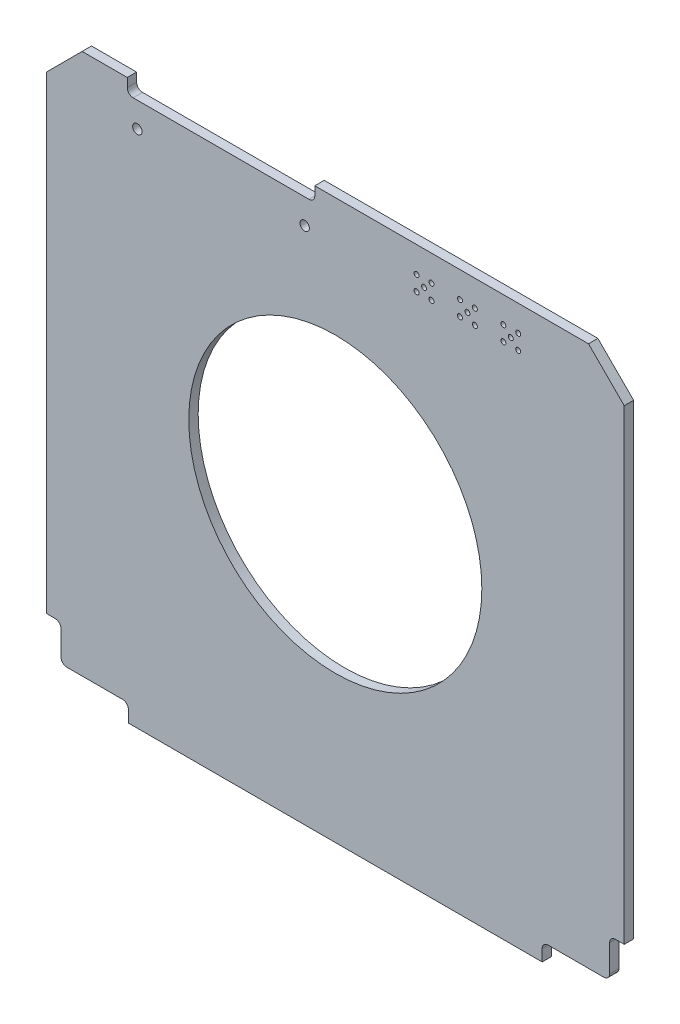
from build123d import *

# Parameters (mm, degrees)
SKETCH1_R           = 0.425
SKETCH1_R_2         = 25
SKETCH1_R_3         = 0.8
BOSS_EXTRUDE1_DEPTH = 1.6


with BuildPart() as part:
    # Sketch1 → Boss-Extrude1 (new body)
    with BuildSketch(Plane(origin=(0, 0, -0.0125), x_dir=(-1, 0, 0), z_dir=(0, 0, -1))):
        with BuildLine():
            Line((47.8, -40.8), (49.3, -40.8))
            Line((49.3, -40.8), (49.3, 39.2))
            Line((49.3, 39.2), (43.2, 45.3))
            Line((43.2, 45.3), (35.500000017, 45.3))
            Line((35.500000017, 45.3), (35.500000017, 43.8))
            ThreePointArc((35.500000017, 43.8), (35.207106799, 43.092893219), (34.500000017, 42.8))
            Line((34.500000017, 42.8), (4.500000014, 42.8))
            ThreePointArc((4.500000014, 42.8), (3.792893232, 43.092893219), (3.500000014, 43.8))
            Line((3.500000014, 43.8), (3.500000014, 45.3))
            Line((3.500000014, 45.3), (-43.2, 45.3))
            Line((-43.2, 45.3), (-49.3, 39.2))
            Line((-49.3, 39.2), (-49.3, -40.4))
            Line((-49.3, -40.4), (-47.8, -40.4))
            ThreePointArc((-47.8, -40.4), (-47.092893219, -40.692893219), (-46.8, -41.4))
            Line((-46.8, -41.4), (-46.8, -46))
            ThreePointArc((-46.8, -46), (-46.507106781, -46.707106781), (-45.8, -47))
            Line((-45.8, -47), (-36.3, -47))
            ThreePointArc((-36.3, -47), (-35.592893219, -47.292893219), (-35.3, -48))
            Line((-35.3, -48), (-35.3, -50))
            Line((-35.3, -50), (35.3, -50))
            Line((35.3, -50), (35.3, -48))
            ThreePointArc((35.3, -48), (35.592893219, -47.292893219), (36.3, -47))
            Line((36.3, -47), (45.8, -47))
            ThreePointArc((45.8, -47), (46.507106781, -46.707106781), (46.8, -46))
            Line((46.8, -46), (46.8, -41.8))
            ThreePointArc((46.8, -41.8), (47.092893219, -41.092893219), (47.8, -40.8))
        make_face()
        with Locations(Location((-13.87, 38.33, 0), (0, 0, 180))):
            Circle(SKETCH1_R, mode=Mode.SUBTRACT)
        Circle(SKETCH1_R_2, mode=Mode.SUBTRACT)
        with Locations(Location((-22.54, 39.6, 0), (0, 0, 180))):
            Circle(SKETCH1_R, mode=Mode.SUBTRACT)
        with Locations(Location((-23.81, 40.87, 0), (0, 0, 180))):
            Circle(SKETCH1_R, mode=Mode.SUBTRACT)
        with Locations(Location((-21.27, 40.87, 0), (0, 0, 180))):
            Circle(SKETCH1_R, mode=Mode.SUBTRACT)
        with Locations(Location((-13.87, 40.87, 0), (0, 0, 180))):
            Circle(SKETCH1_R, mode=Mode.SUBTRACT)
        with Locations(Location((-31.21, 40.87, 0), (0, 0, 180))):
            Circle(SKETCH1_R, mode=Mode.SUBTRACT)
        with Locations(Location((-16.41, 40.87, 0), (0, 0, 180))):
            Circle(SKETCH1_R, mode=Mode.SUBTRACT)
        with Locations(Location((-15.14, 39.6, 0), (0, 0, 180))):
            Circle(SKETCH1_R, mode=Mode.SUBTRACT)
        with Locations(Location((-29.94, 39.6, 0), (0, 0, 180))):
            Circle(SKETCH1_R, mode=Mode.SUBTRACT)
        with Locations(Location((-28.67, 40.87, 0), (0, 0, 180))):
            Circle(SKETCH1_R, mode=Mode.SUBTRACT)
        with Locations(Location((-28.67, 38.33, 0), (0, 0, 180))):
            Circle(SKETCH1_R, mode=Mode.SUBTRACT)
        with Locations(Location((-16.41, 38.33, 0), (0, 0, 180))):
            Circle(SKETCH1_R, mode=Mode.SUBTRACT)
        with Locations(Location((-21.27, 38.33, 0), (0, 0, 180))):
            Circle(SKETCH1_R, mode=Mode.SUBTRACT)
        with Locations(Location((-23.81, 38.33, 0), (0, 0, 180))):
            Circle(SKETCH1_R, mode=Mode.SUBTRACT)
        with Locations(Location((-31.21, 38.33, 0), (0, 0, 180))):
            Circle(SKETCH1_R, mode=Mode.SUBTRACT)
        with Locations((33.775, 38.54)):
            Circle(SKETCH1_R_3, mode=Mode.SUBTRACT)
        with Locations((5.225, 38.54)):
            Circle(SKETCH1_R_3, mode=Mode.SUBTRACT)
    extrude(amount=-BOSS_EXTRUDE1_DEPTH)


solid = part.part
